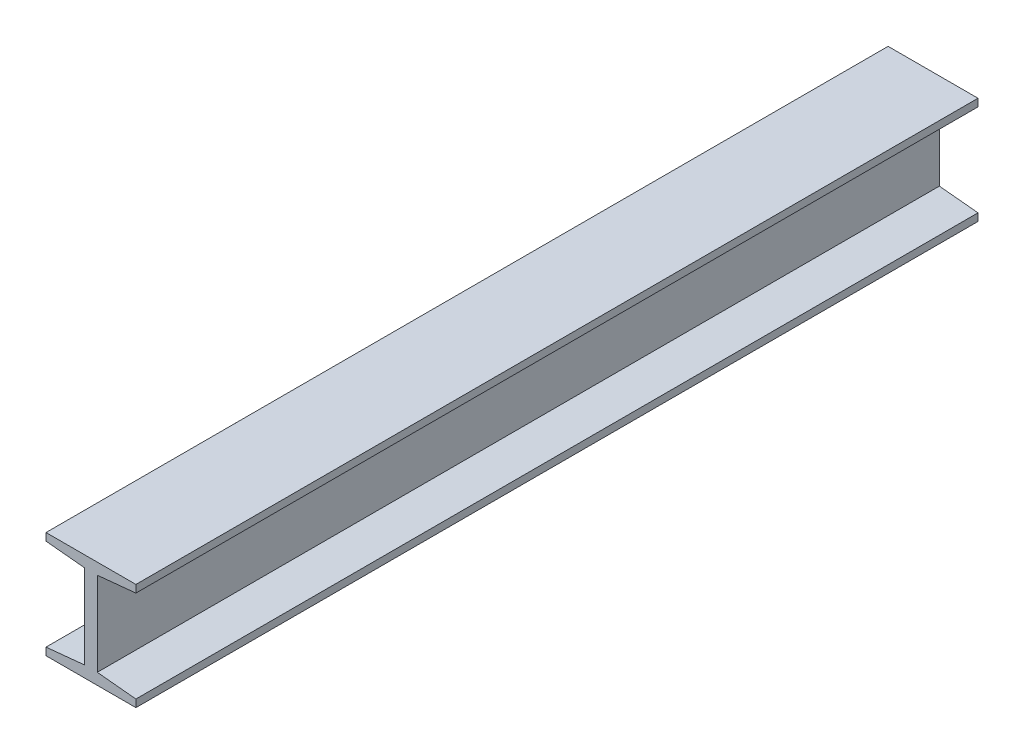
from build123d import *

# Parameters (mm, degrees)
BOSS_EXTRUDE1_DEPTH = 600


with BuildPart() as part:
    # Sketch1 → Boss-Extrude1 (new body)
    with BuildSketch(Plane.XY):
        Polygon((-32.03, 38.025), (32.03, 38.025), (32.03, 32.68), (4.51, 29.965), (4.51, -29.965), (32.03, -32.68), (32.03, -38.025), (-32.03, -38.025), (-32.03, -32.68), (-4.51, -29.965), (-4.51, 29.965), (-32.03, 32.68), align=None)
    extrude(amount=BOSS_EXTRUDE1_DEPTH)


solid = part.part
